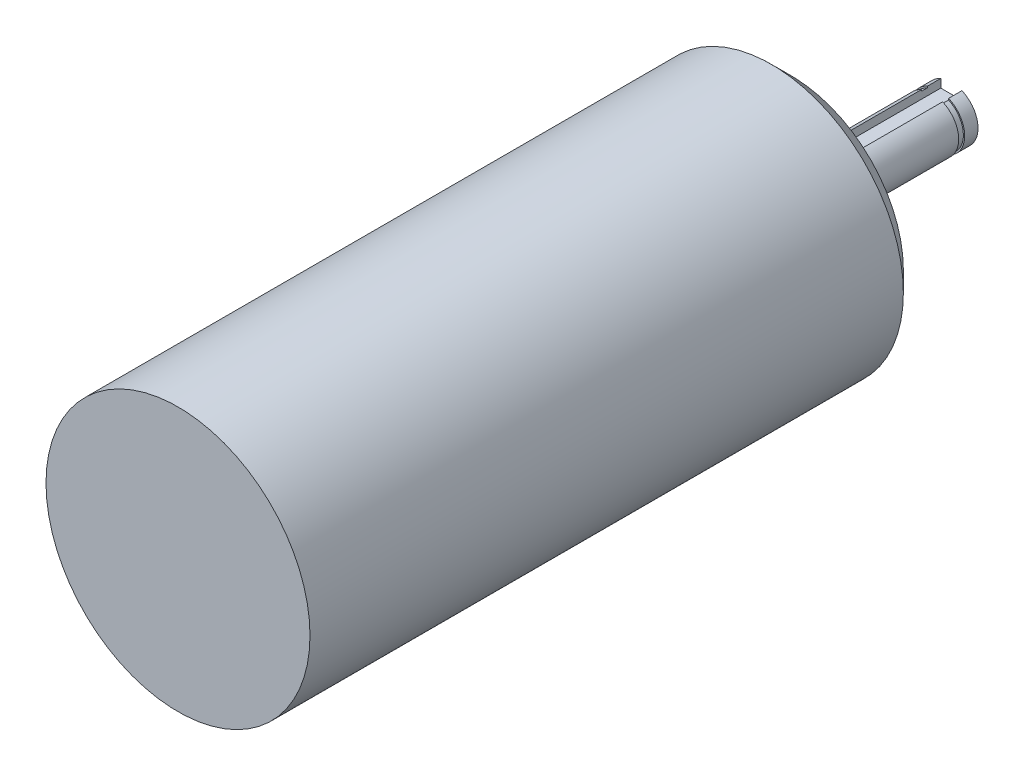
from build123d import *

# Parameters (mm, degrees)
SKETCH1_R                       = 19.8
BOSS_EXTRUDE1_DEPTH             = 92
M4X0_7_TAPPED_HOLE1_D           = 3.3
M4X0_7_TAPPED_HOLE1_DEPTH       = 4
M4X0_7_TAPPED_HOLE1_CSINK_D     = 4.05
M4X0_7_TAPPED_HOLE1_CSINK_ANGLE = 90
M4X0_7_TAPPED_HOLE1_TIP         = 0.991420021
SKETCH6_R                       = 4
BOSS_EXTRUDE2_DEPTH             = 24
CHAMFER1_SIZE                   = 3
SKETCH7_W                       = 3.175
SKETCH7_H                       = 3.175
CUT_EXTRUDE1_DEPTH              = 19
CUT_EXTRUDE2_START              = -0.9
SKETCH8_R                       = 4
SKETCH8_R_2                     = 3.8
CUT_EXTRUDE2_DEPTH              = 0.9


with BuildPart() as part:
    # Sketch1 → Boss-Extrude1 (new body)
    with BuildSketch(Plane.XY):
        Circle(SKETCH1_R)
    extrude(amount=BOSS_EXTRUDE1_DEPTH)

    # M4x0.7 Tapped Hole1
    with Locations(Plane(origin=(0, 0, 0), x_dir=(-1, 0, 0), z_dir=(0, 0, -1))):
        with Locations((0, 12.5), (-12.5, 0), (0, -12.5), (12.5, 0)):
            CounterSinkHole(M4X0_7_TAPPED_HOLE1_D / 2, M4X0_7_TAPPED_HOLE1_CSINK_D / 2, depth=M4X0_7_TAPPED_HOLE1_DEPTH, counter_sink_angle=M4X0_7_TAPPED_HOLE1_CSINK_ANGLE)
            with Locations((0, 0, -(M4X0_7_TAPPED_HOLE1_DEPTH + M4X0_7_TAPPED_HOLE1_TIP / 2))):  # 118° drill point
                Cone(0, M4X0_7_TAPPED_HOLE1_D / 2, M4X0_7_TAPPED_HOLE1_TIP, mode=Mode.SUBTRACT)

    # Sketch6 → Boss-Extrude2 (add)
    with BuildSketch(Plane(origin=(0, 0, 0), x_dir=(-1, 0, 0), z_dir=(0, 0, -1))):
        Circle(SKETCH6_R)
    extrude(amount=BOSS_EXTRUDE2_DEPTH)

    # Chamfer1
    chamfer1_edges = [part.edges().sort_by_distance(p)[0] for p in [
        (-19.8, 0, 0),
    ]]
    chamfer(chamfer1_edges, length=CHAMFER1_SIZE)

    # Sketch7 → Cut-Extrude1 (cut)
    with BuildSketch(Plane(origin=(0, 0, -24), x_dir=(-1, 0, 0), z_dir=(0, 0, -1))):
        with Locations((0, 4)):
            Rectangle(SKETCH7_W, SKETCH7_H)
    extrude(amount=-CUT_EXTRUDE1_DEPTH, mode=Mode.SUBTRACT)

    # Sketch8 → Cut-Extrude2 (cut)
    with BuildSketch(Plane(origin=(0, 0, -22), x_dir=(-1, 0, 0), z_dir=(0, 0, -1)).offset(CUT_EXTRUDE2_START)):
        with Locations(Location((0, 0, 0), (0, 0, 113.382964427))):
            Circle(SKETCH8_R)
        Circle(SKETCH8_R_2, mode=Mode.SUBTRACT)
    extrude(amount=CUT_EXTRUDE2_DEPTH, mode=Mode.SUBTRACT)


solid = part.part
